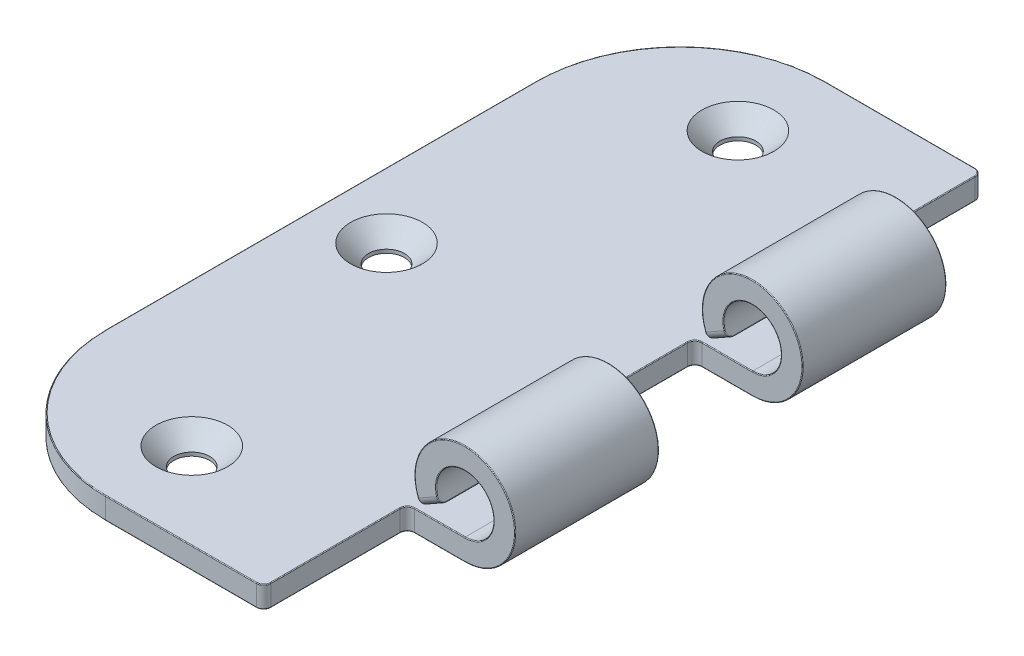
from build123d import *

# Parameters (mm, degrees)
BOSS_EXTRUDE1_DEPTH = 100
CUT_EXTRUDE1_START  = -52
SKETCH2_W           = 26.232076442
SKETCH2_H           = 20
CUT_EXTRUDE1_DEPTH  = 100
LPATTERN1_COUNT     = 6
LPATTERN1_PITCH     = 40
FILLET1_R           = 1
FILLET2_R           = 1
SKETCH3_R           = 2.5
CUT_EXTRUDE2_DEPTH  = 10
CHAMFER1_SIZE       = 2.5
FILLET3_R           = 20
FILLET4_R           = 1
FILLET5_R           = 0.1


with BuildPart() as part:
    # Sketch1 → Boss-Extrude1 (new body)
    with BuildSketch(Plane.XY):
        with BuildLine():
            Line((0, -7), (-50, -7))
            Line((-50, -7), (-50, -4))
            Line((-50, -4), (0, -4))
            ThreePointArc((0, -4), (2.013924217, 3.456025065), (-3.480086286, -1.972054624))
            Line((-3.480086286, -1.972054624), (-6.090151001, -3.451095592))
            ThreePointArc((-6.090151001, -3.451095592), (3.52436738, 6.048043863), (0, -7))
        make_face()
    extrude(amount=BOSS_EXTRUDE1_DEPTH)

    # Sketch2 → Cut-Extrude1 (cut)
    with BuildSketch(Plane(origin=(0, -4, 0), x_dir=(1, 0, 0), z_dir=(0, 1, 0)).offset(CUT_EXTRUDE1_START)):
        with Locations((5.116038221, -10)):
            Rectangle(SKETCH2_W, SKETCH2_H)
    cut_extrude1 = extrude(amount=CUT_EXTRUDE1_DEPTH, mode=Mode.SUBTRACT)

    # LPattern1: Cut-Extrude1 ×6
    with Locations(*[(0, 0, i * LPATTERN1_PITCH) for i in range(1, LPATTERN1_COUNT)]):
        add(cut_extrude1, mode=Mode.SUBTRACT)

    # Fillet1
    fillet1_edges = [part.edges().sort_by_distance(p)[0] for p in [
        (-8, -5.5, 80),
    ]]
    fillet(fillet1_edges, radius=FILLET1_R)

    # Fillet2
    fillet2_edges = [part.edges().sort_by_distance(p)[0] for p in [
        (-8, -5.5, 20),
        (-8, -5.5, 40),
        (-8, -5.5, 60),
    ]]
    fillet(fillet2_edges, radius=FILLET2_R)

    # Sketch3 → Cut-Extrude2 (cut)
    with BuildSketch(Plane(origin=(0, -4, 0), x_dir=(1, 0, 0), z_dir=(0, 1, 0))):
        with Locations(Location((-30, -12, 0), (0, 0, 270))):
            Circle(SKETCH3_R)
        with Locations(Location((-40.898351451, -50, 0), (0, 0, 270))):
            Circle(SKETCH3_R)
        with Locations(Location((-30, -88, 0), (0, 0, 180))):
            Circle(SKETCH3_R)
    extrude(amount=-CUT_EXTRUDE2_DEPTH, mode=Mode.SUBTRACT)

    # Chamfer1
    chamfer1_edges = [part.edges().sort_by_distance(p)[0] for p in [
        (-30, -4, 9.5),
        (-40.898351451, -4, 47.5),
        (-27.5, -4, 88),
    ]]
    chamfer(chamfer1_edges, length=CHAMFER1_SIZE)

    # Fillet3
    fillet3_edges = [part.edges().sort_by_distance(p)[0] for p in [
        (-50, -5.5, 100),
        (-50, -5.5, 0),
    ]]
    fillet(fillet3_edges, radius=FILLET3_R)

    # Fillet4
    fillet4_edges = [part.edges().sort_by_distance(p)[0] for p in [
        (-8, -5.5, 0),
        (-4.785118643, -2.711575108, 20),
        (-8, -5.5, 100),
        (-4.785118643, -2.711575108, 80),
        (-4.785118643, -2.711575108, 40),
        (-4.785118643, -2.711575108, 60),
    ]]
    fillet(fillet4_edges, radius=FILLET4_R)

    # Fillet5
    fillet5_edges = [part.edges().sort_by_distance(p)[0] for p in [
        (-3.5, -7, 80),
        (-8, -4, 90),
        (-7.707106781, -7, 80.292893219),
        (-7.707106781, -4, 80.292893219),
        (-8, -7, 10),
        (-3.5, -4, 20),
        (-3.5, -7, 40),
        (-8, -4, 50),
        (-8, -7, 50),
        (-3.5, -4, 60),
        (-7.707106781, -7, 19.707106781),
        (-7.707106781, -4, 19.707106781),
        (-7.707106781, -7, 40.292893219),
        (-7.707106781, -4, 40.292893219),
        (-7.707106781, -7, 59.707106781),
        (-7.707106781, -4, 59.707106781),
        (-50, -7, 50),
        (-50, -4, 50),
        (-19.5, -7, 100),
        (-19.5, -7, 0),
        (-44.142135624, -7, 94.142135624),
        (-44.142135624, -7, 5.857864376),
        (-44.142135624, -4, 94.142135624),
        (-44.142135624, -4, 5.857864376),
        (2.433346622, 3.174716399, 80),
        (-3.480086286, -1.972054624, 70),
        (-3.616635295, -1.708785869, 60.289433427),
        (-3.616635295, -1.708785869, 79.710566573),
        (-6.090151001, -3.451095592, 70),
        (3.948433827, 5.780127188, 60),
        (-6.229724976, -3.192260445, 60.291784131),
        (-6.229724968, -3.192260456, 79.708215844),
        (2.433346622, 3.174716399, 40),
        (-3.480086286, -1.972054624, 30),
        (-3.616635295, -1.708785869, 20.289433427),
        (-3.616635295, -1.708785869, 39.710566573),
        (-6.090151001, -3.451095592, 30),
        (3.948433827, 5.780127188, 20),
        (-6.229724973, -3.192260451, 20.291784137),
        (-6.229724968, -3.192260456, 39.708215844),
        (-8, -4, 10),
        (-19.5, -4, 0),
        (-19.5, -4, 100),
        (-8.292893219, -4, 99.707106781),
        (-8.292893219, -4, 0.292893219),
        (-8, -7, 90),
        (-8.292893219, -7, 99.707106781),
        (-8.292893219, -7, 0.292893219),
        (2.433346622, 3.174716399, 20),
        (-3.5, -7, 20),
        (2.433346622, 3.174716399, 60),
        (-3.5, -7, 60),
        (-3.5, -4, 40),
        (3.948433827, 5.780127188, 40),
        (-3.5, -4, 80),
        (3.948433827, 5.780127188, 80),
    ]]
    fillet(fillet5_edges, radius=FILLET5_R)


solid = part.part
